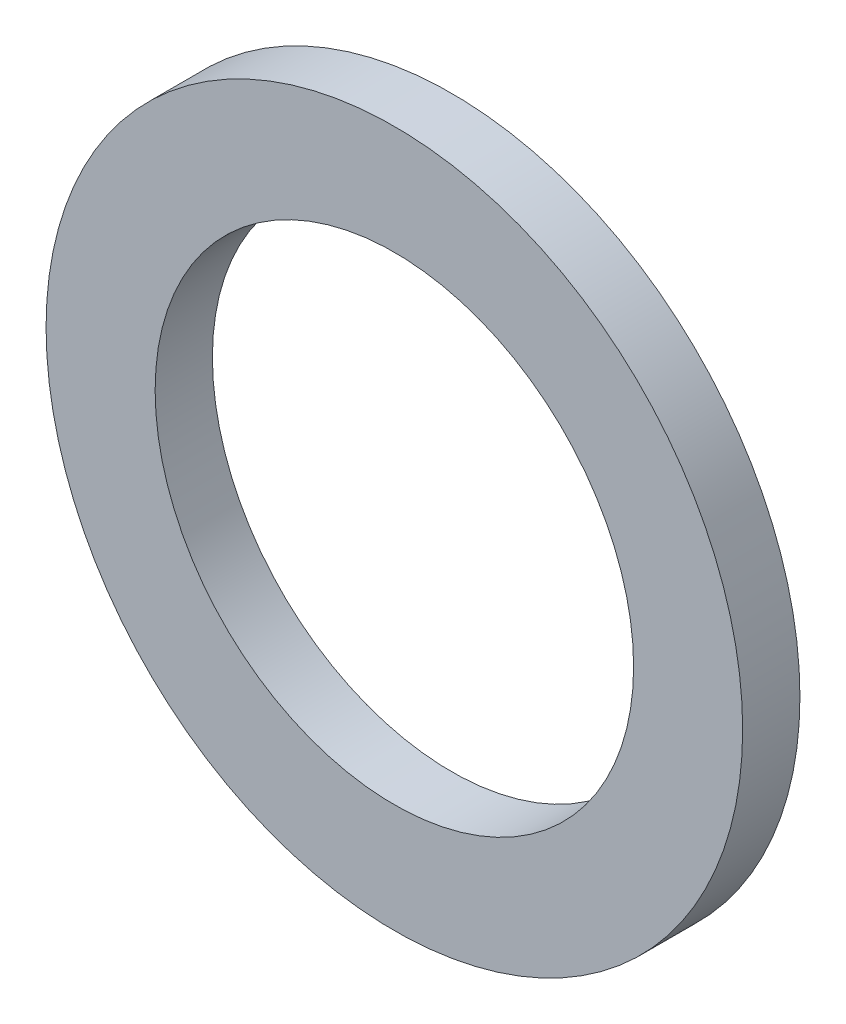
from build123d import *

# Parameters (mm, degrees)
SKETCH1_R           = 6.4897
SKETCH1_R_2         = 4.4577
BOSS_EXTRUDE1_DEPTH = 1.0668


with BuildPart() as part:
    # Sketch1 → Boss-Extrude1 (new body)
    with BuildSketch(Plane.XY):
        Circle(SKETCH1_R)
        Circle(SKETCH1_R_2, mode=Mode.SUBTRACT)
    extrude(amount=BOSS_EXTRUDE1_DEPTH)


solid = part.part
